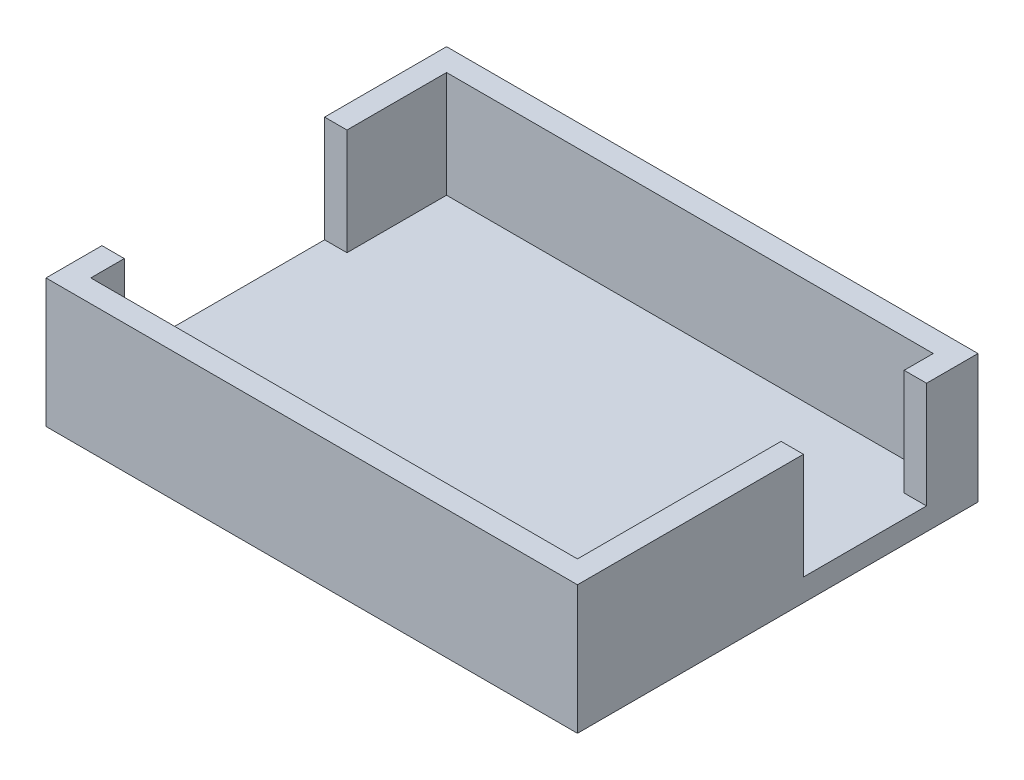
from build123d import *

# Parameters (mm, degrees)
ESQUISSE1_W        = 47.5
ESQUISSE1_H        = 35.8
BOSS_EXTRU_2_DEPTH = 2
ESQUISSE2_W        = 47.5
ESQUISSE2_H        = 2
BOSS_EXTRU_3_DEPTH = 9.5
ESQUISSE3_W        = 47.5
ESQUISSE3_H        = 2
BOSS_EXTRU_4_DEPTH = 9.5
ESQUISSE4_W        = 2
ESQUISSE4_H        = 2.6
BOSS_EXTRU_5_DEPTH = 9.5
ESQUISSE5_W        = 2
ESQUISSE5_H        = 18.2
BOSS_EXTRU_6_DEPTH = 9.5
ESQUISSE6_W        = 2
ESQUISSE6_H        = 8.9
BOSS_EXTRU_7_DEPTH = 9.5
ESQUISSE8_W        = 2
ESQUISSE8_H        = 3
BOSS_EXTRU_8_DEPTH = 9.5


with BuildPart() as part:
    # Esquisse1 → Boss.-Extru.2 (new body)
    with BuildSketch(Plane(origin=(0, 0, 0), x_dir=(1, 0, 0), z_dir=(0, 1, 0))):
        with Locations((23.75, -17.9)):
            Rectangle(ESQUISSE1_W, ESQUISSE1_H)
    extrude(amount=BOSS_EXTRU_2_DEPTH)

    # Esquisse2 → Boss.-Extru.3 (add)
    with BuildSketch(Plane(origin=(0, 2, 0), x_dir=(1, 0, 0), z_dir=(0, 1, 0))):
        with Locations((23.75, -34.8)):
            Rectangle(ESQUISSE2_W, ESQUISSE2_H)
    extrude(amount=BOSS_EXTRU_3_DEPTH)

    # Esquisse3 → Boss.-Extru.4 (add)
    with BuildSketch(Plane(origin=(0, 2, 0), x_dir=(1, 0, 0), z_dir=(0, 1, 0))):
        with Locations((23.75, -1)):
            Rectangle(ESQUISSE3_W, ESQUISSE3_H)
    extrude(amount=BOSS_EXTRU_4_DEPTH)

    # Esquisse4 → Boss.-Extru.5 (add)
    with BuildSketch(Plane(origin=(0, 2, 0), x_dir=(1, 0, 0), z_dir=(0, 1, 0))):
        with Locations((46.5, -3.3)):
            Rectangle(ESQUISSE4_W, ESQUISSE4_H)
    extrude(amount=BOSS_EXTRU_5_DEPTH)

    # Esquisse5 → Boss.-Extru.6 (add)
    with BuildSketch(Plane(origin=(0, 2, 0), x_dir=(1, 0, 0), z_dir=(0, 1, 0))):
        with Locations((46.5, -24.7)):
            Rectangle(ESQUISSE5_W, ESQUISSE5_H)
    extrude(amount=BOSS_EXTRU_6_DEPTH)

    # Esquisse6 → Boss.-Extru.7 (add)
    with BuildSketch(Plane(origin=(0, 2, 0), x_dir=(1, 0, 0), z_dir=(0, 1, 0))):
        with Locations((1, -6.45)):
            Rectangle(ESQUISSE6_W, ESQUISSE6_H)
    extrude(amount=BOSS_EXTRU_7_DEPTH)

    # Esquisse8 → Boss.-Extru.8 (add)
    with BuildSketch(Plane(origin=(0, 2, 0), x_dir=(1, 0, 0), z_dir=(0, 1, 0))):
        with Locations((1, -32.3)):
            Rectangle(ESQUISSE8_W, ESQUISSE8_H)
    extrude(amount=BOSS_EXTRU_8_DEPTH)


solid = part.part
